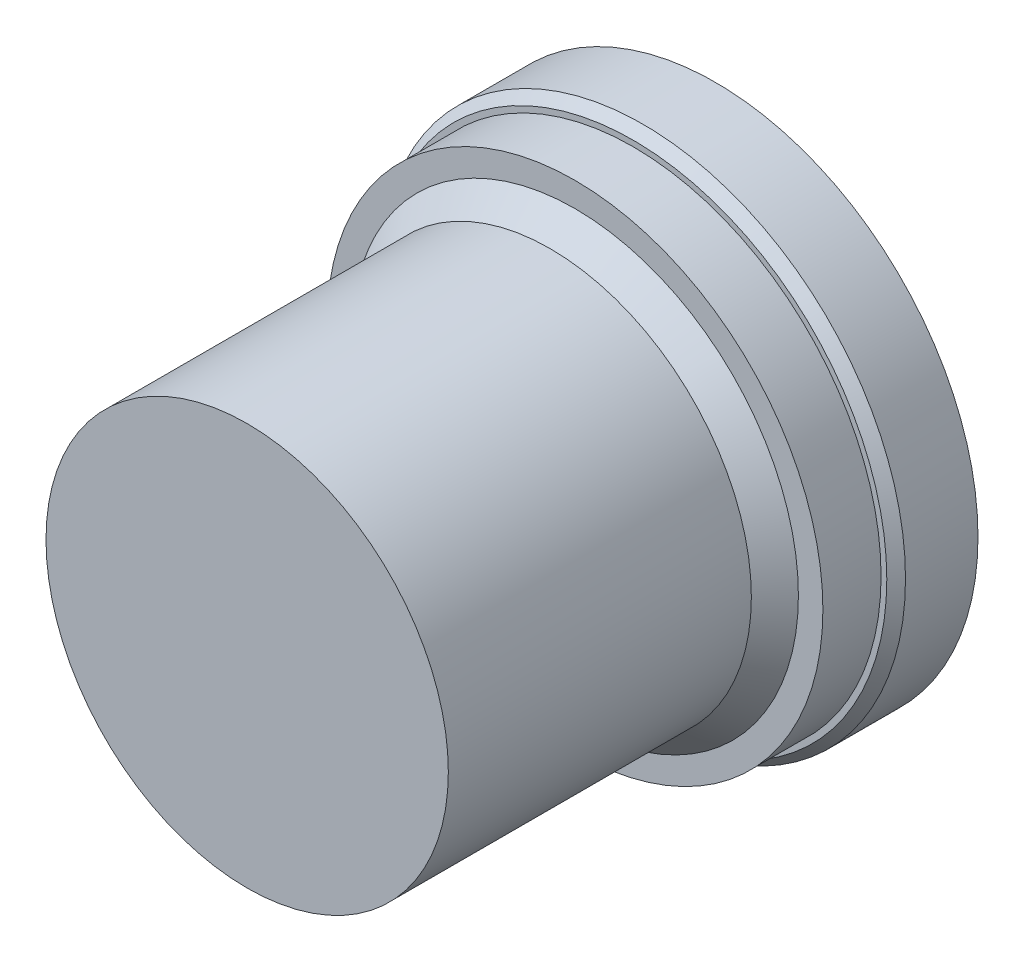
from build123d import *


with BuildPart() as part:
    # Sketch3 → Revolve1 (revolve)
    with BuildSketch(Plane(origin=(0, 0, 0), x_dir=(0, 0, -1), z_dir=(1, 0, 0)), mode=Mode.PRIVATE) as revolve1_sk:
        Polygon((40.827672453, 0), (40.827672453, 20.9677), (35.036472453, 20.9677), (34.249072453, 20.261058974), (34.249072453, 19.803858974), (29.600872453, 19.803858974), (29.600872453, 17.848058974), (27.619672453, 16.070058974), (3.413472453, 16.070058974), (3.413472453, 0), align=None)
    revolve(revolve1_sk.sketch.rotate(Axis((0, 0, 72.635277736), (0, 0, -1)), 90), axis=Axis((0, 0, 72.635277736), (0, 0, -1)))


solid = part.part
